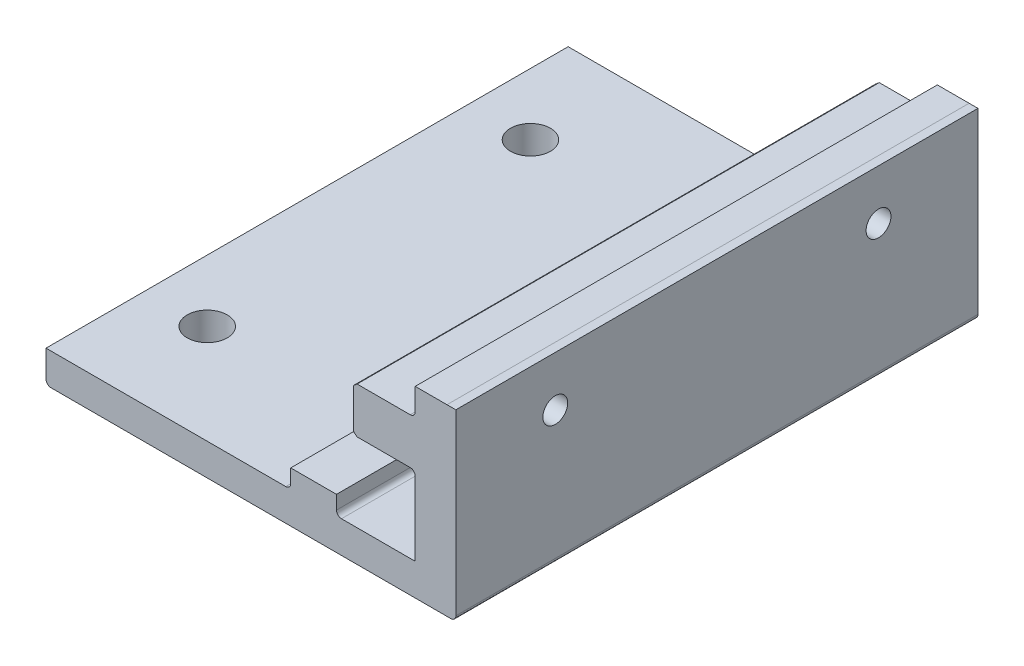
from build123d import *

# Parameters (mm, degrees)
BOSS_EXTRUDE1_DEPTH        = 66.675
CUT_EXTRUDE1_REACH         = 75.8
CUT_EXTRUDE2_REACH         = 75.8
SKETCH6_W                  = 66.675
SKETCH6_H                  = 4.064
BOSS_EXTRUDE2_DEPTH        = 22.21738
F_10_CLEARANCE_HOLE1_D     = 5.1054
SKETCH12_W                 = 5.842
SKETCH12_H                 = 5.49275
CUT_EXTRUDE4_DEPTH         = 77.796738301
F_4_CLEARANCE_HOLE1_D      = 3.2639
SKETCH19_W                 = 66.675
SKETCH19_H                 = 23.410344024
BOSS_EXTRUDE7_DEPTH        = 1.12776
F_1_8_0_1250_DOWEL_HOLE1_D = 3.175
SKETCH20_W                 = 1.016
SKETCH20_H                 = 4.064
CUT_EXTRUDE5_DEPTH         = 77.796821417
FILLET1_R                  = 0.635


with BuildPart() as part:
    # Sketch1 → Boss-Extrude1 (new body)
    with BuildSketch(Plane(origin=(0, 0, -3683), x_dir=(-1, 0, 0), z_dir=(0, 0, -1))):
        with BuildLine():
            Line((7.945265893, 3.588862728), (-1.198734107, 3.588862728))
            ThreePointArc((-1.198734107, 3.588862728), (-1.647746913, 3.774849922), (-1.833734107, 4.223862728))
            Line((-1.833734107, 4.223862728), (-1.833734107, 5.747862728))
            ThreePointArc((-1.833734107, 5.747862728), (-1.647746913, 6.196875535), (-1.198734107, 6.382862728))
            Line((-1.198734107, 6.382862728), (1.621629442, 6.382862728))
            Line((1.621629442, 6.382862728), (1.621629442, 6.890862686))
            Line((1.621629442, 6.890862686), (-2.214734107, 11.462862728))
            Line((-2.214734107, 11.462862728), (-7.294734107, 11.462862728))
            Line((-7.294734107, 11.462862728), (-11.131097656, 6.890862686))
            Line((-11.131097656, 6.890862686), (-11.131097656, 6.382862728))
            Line((-11.131097656, 6.382862728), (-8.310734107, 6.382862728))
            ThreePointArc((-8.310734107, 6.382862728), (-7.861721301, 6.196875535), (-7.675734107, 5.747862728))
            Line((-7.675734107, 5.747862728), (-7.675734107, 4.223862728))
            ThreePointArc((-7.675734107, 4.223862728), (-7.861721301, 3.774849922), (-8.310734107, 3.588862728))
            Line((-8.310734107, 3.588862728), (-17.454734107, 3.588862728))
            Line((-17.454734107, 3.588862728), (-17.727921752, 3.588862728))
            Line((-17.727921752, 3.588862728), (-17.727921752, 3.858842754))
            Line((-17.727921752, 3.858842754), (-17.728361466, 13.002372481))
            ThreePointArc((-17.728361466, 13.002372481), (-17.542256287, 13.451715967), (-17.092921752, 13.637842754))
            Line((-17.092921752, 13.637842754), (-15.568921752, 13.637842754))
            ThreePointArc((-15.568921752, 13.637842754), (-15.119908946, 13.45185556), (-14.933921752, 13.002842754))
            Line((-14.933921752, 13.002842754), (-14.933921752, 10.182479205))
            Line((-14.933921752, 10.182479205), (-14.425921794, 10.182479205))
            Line((-14.425921794, 10.182479205), (-9.853921752, 14.018842754))
            Line((-9.853921752, 14.018842754), (-9.853921752, 19.098842754))
            Line((-9.853921752, 19.098842754), (-14.425921794, 22.935206303))
            Line((-14.425921794, 22.935206303), (-14.933921752, 22.935206303))
            Line((-14.933921752, 22.935206303), (-14.933921752, 20.114842754))
            ThreePointArc((-14.933921752, 20.114842754), (-15.119908946, 19.665829948), (-15.568921752, 19.479842754))
            Line((-15.568921752, 19.479842754), (-17.092921752, 19.479842754))
            ThreePointArc((-17.092921752, 19.479842754), (-17.542476558, 19.66604812), (-17.728703542, 20.11559397))
            Line((-17.728703542, 20.11559397), (-17.728839138, 22.935206303))
            Line((-17.728839138, 22.935206303), (-21.787214199, 22.935206303))
            Line((-21.787214199, 22.935206303), (-21.791921752, 3.859128788))
            Line((-21.791921752, 3.859128788), (-21.791921752, 3.588862728))
            Line((-21.791921752, 3.588862728), (-21.791921752, -0.475137272))
            Line((-21.791921752, -0.475137272), (-17.727921752, -0.475137272))
            Line((-17.727921752, -0.475137272), (-17.454774021, -0.475137272))
            Line((-17.454774021, -0.475137272), (7.945225979, -0.475137272))
            Line((7.945225979, -0.475137272), (8.215492039, -0.475137272))
            Line((8.215492039, -0.475137272), (8.215492039, 3.588862728))
            Line((8.215492039, 3.588862728), (7.945265893, 3.588862728))
        make_face()
    extrude(amount=BOSS_EXTRUDE1_DEPTH)

    # Sketch2 → Cut-Extrude1 (cut, up to next)
    with BuildSketch(Plane.XY.offset(-3683), mode=Mode.PRIVATE) as cut_extrude1_sk1:
        with BuildLine():
            Line((11.131097656, 6.890862686), (11.131097656, 6.382862728))
            Line((11.131097656, 6.382862728), (8.310734107, 6.382862728))
            ThreePointArc((8.310734107, 6.382862728), (7.861721301, 6.196875535), (7.675734107, 5.747862728))
            Line((7.675734107, 5.747862728), (7.675734107, 11.00880461))
            Line((7.675734107, 11.00880461), (11.131097656, 6.890862686))
        make_face()
    cut_extrude1_tool1 = extrude(cut_extrude1_sk1.sketch, amount=-CUT_EXTRUDE1_REACH, mode=Mode.PRIVATE) & part.part
    # Sketch2 → Cut-Extrude1 (cut, up to next)
    with BuildSketch(Plane.XY.offset(-3683), mode=Mode.PRIVATE) as cut_extrude1_sk2:
        with BuildLine():
            Line((1.833734107, 5.747862728), (1.833734107, 11.00880461))
            Line((1.833734107, 11.00880461), (-1.621629442, 6.890862686))
            Line((-1.621629442, 6.890862686), (-1.621629442, 6.382862728))
            Line((-1.621629442, 6.382862728), (1.198734107, 6.382862728))
            ThreePointArc((1.198734107, 6.382862728), (1.647746913, 6.196875535), (1.833734107, 5.747862728))
        make_face()
    cut_extrude1_tool2 = extrude(cut_extrude1_sk2.sketch, amount=-CUT_EXTRUDE1_REACH, mode=Mode.PRIVATE) & part.part
    add(cut_extrude1_tool1.solids().sort_by_distance((8.930632, 7.925168, -3683))[0], mode=Mode.SUBTRACT)
    add(cut_extrude1_tool2.solids().sort_by_distance((0.578837, 7.925168, -3683))[0], mode=Mode.SUBTRACT)

    # Sketch3 → Cut-Extrude2 (cut, up to next)
    with BuildSketch(Plane.XY.offset(-3683), mode=Mode.PRIVATE) as cut_extrude2_sk1:
        with BuildLine():
            Line((15.568921752, 19.479842754), (10.307979871, 19.479842754))
            Line((10.307979871, 19.479842754), (14.425921794, 22.935206303))
            Line((14.425921794, 22.935206303), (14.933921752, 22.935206303))
            Line((14.933921752, 22.935206303), (14.933921752, 20.114842754))
            ThreePointArc((14.933921752, 20.114842754), (15.119908946, 19.665829948), (15.568921752, 19.479842754))
        make_face()
    cut_extrude2_tool1 = extrude(cut_extrude2_sk1.sketch, amount=-CUT_EXTRUDE2_REACH, mode=Mode.PRIVATE) & part.part
    # Sketch3 → Cut-Extrude2 (cut, up to next)
    with BuildSketch(Plane.XY.offset(-3683), mode=Mode.PRIVATE) as cut_extrude2_sk2:
        with BuildLine():
            Line((10.307979871, 13.637842754), (14.425921794, 10.182479205))
            Line((14.425921794, 10.182479205), (14.933921752, 10.182479205))
            Line((14.933921752, 10.182479205), (14.933921752, 13.002842754))
            ThreePointArc((14.933921752, 13.002842754), (15.119908946, 13.45185556), (15.568921752, 13.637842754))
            Line((15.568921752, 13.637842754), (10.307979871, 13.637842754))
        make_face()
    cut_extrude2_tool2 = extrude(cut_extrude2_sk2.sketch, amount=-CUT_EXTRUDE2_REACH, mode=Mode.PRIVATE) & part.part
    add(cut_extrude2_tool1.solids().sort_by_distance((13.391616, 20.73474, -3683))[0], mode=Mode.SUBTRACT)
    add(cut_extrude2_tool2.solids().sort_by_distance((13.391616, 12.382945, -3683))[0], mode=Mode.SUBTRACT)

    # Sketch6 → Boss-Extrude2 (add)
    with BuildSketch(Plane.ZY.offset(8.215492039)):
        with Locations((-3716.3375, 1.556862728)):
            Rectangle(SKETCH6_W, SKETCH6_H)
    extrude(amount=BOSS_EXTRUDE2_DEPTH)

    # #10 Clearance Hole1 (through all)
    with Locations(Plane(origin=(0, 3.588862728, 0), x_dir=(1, 0, 0), z_dir=(0, 1, 0))):
        with Locations((-21.530172039, 3736.975), (-21.530172039, 3695.7)):
            Hole(F_10_CLEARANCE_HOLE1_D / 2)

    # Sketch12 → Cut-Extrude4 (cut, through all)
    with BuildSketch(Plane(origin=(0, 0, -3749.675), x_dir=(-1, 0, 0), z_dir=(0, 0, -1))):
        with Locations((-4.754734107, 8.716487728)):
            Rectangle(SKETCH12_W, SKETCH12_H)
    extrude(amount=-CUT_EXTRUDE4_DEPTH, mode=Mode.SUBTRACT)

    # #4 Clearance Hole1 (through all)
    with Locations(Plane(origin=(0, 5.970112728, 0), x_dir=(1, 0, 0), z_dir=(0, 1, 0))):
        with Locations((4.754734107, 3736.975), (4.754734107, 3695.7)):
            Hole(F_4_CLEARANCE_HOLE1_D / 2)

    # Sketch19 → Boss-Extrude7 (add)
    with BuildSketch(Plane(origin=(21.792872772, 0.005377998, 0), x_dir=(0, 0, -1), z_dir=(0.9999999695503556, 0.0002467778108309542, 0))):
        with Locations((3716.3375, 11.224656992)):
            Rectangle(SKETCH19_W, SKETCH19_H)
    extrude(amount=BOSS_EXTRUDE7_DEPTH)

    # 1/8 (0.1250) Dowel Hole1 (through all)
    with Locations(Plane.ZY.offset(-9.853921752)):
        with Locations((-3736.975, 16.558842754), (-3695.7, 16.558842754)):
            Hole(F_1_8_0_1250_DOWEL_HOLE1_D / 2)

    # Sketch20 → Cut-Extrude5 (cut, through all)
    with BuildSketch(Plane.XY.offset(-3683)):
        with Locations((-29.924872039, 1.556862728)):
            Rectangle(SKETCH20_W, SKETCH20_H)
    extrude(amount=-CUT_EXTRUDE5_DEPTH, mode=Mode.SUBTRACT)

    # Fillet1
    fillet1_edges = [part.edges().sort_by_distance(p)[0] for p in [
        (22.920751318, -0.474858701, -3716.3375),
        (-29.416872039, -0.475137272, -3716.3375),
    ]]
    fillet(fillet1_edges, radius=FILLET1_R)


solid = part.part
